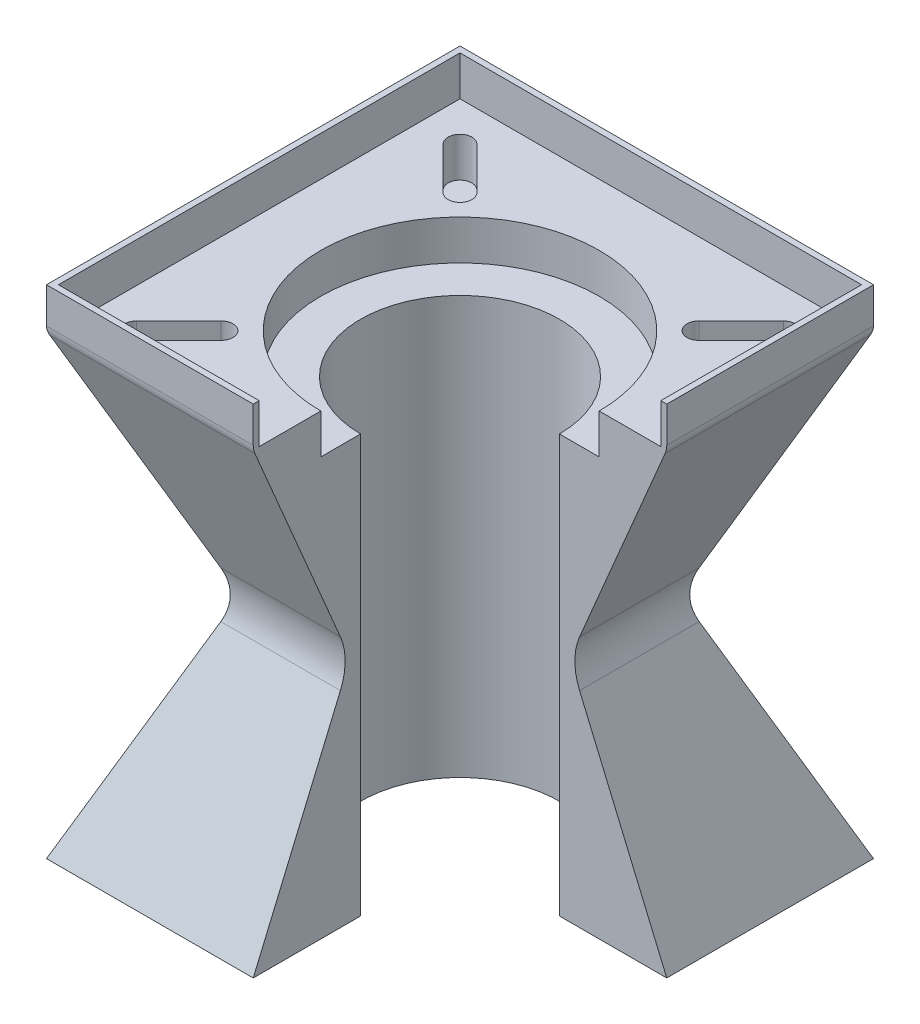
from build123d import *

# Parameters (mm, degrees)
SKETCH1_W               = 104
SKETCH1_H               = 104
BOSS_EXTRUDE1_DEPTH     = 125
CUT_EXTRUDE3_DEPTH      = 125
CUT_EXTRUDE4_DEPTH      = 146.027583583
CUT_EXTRUDE4_DEPTH_BACK = 146.027583583
CUT_EXTRUDE5_DEPTH      = 146.027583583
CUT_EXTRUDE5_DEPTH_BACK = 146.027583583
SKETCH4_R               = 25
SKETCH5_W               = 101
SKETCH5_H               = 101
CUT_EXTRUDE6_DEPTH      = 10
SKETCH6_W               = 52
SKETCH6_H               = 52
CUT_EXTRUDE7_DEPTH      = 125
SKETCH7_W               = 52
SKETCH7_H               = 52
CUT_EXTRUDE8_DEPTH      = 125
SKETCH8_R               = 35
CUT_EXTRUDE9_DEPTH      = 10
CUT_EXTRUDE10_DEPTH     = 10
FILLET3_R               = 5
FILLET4_R               = 15


with BuildPart() as part:
    # Sketch1 → Boss-Extrude1 (new body)
    with BuildSketch(Plane(origin=(0, 0, 0), x_dir=(1, 0, 0), z_dir=(0, 1, 0))):
        Rectangle(SKETCH1_W, SKETCH1_H)
    extrude(amount=BOSS_EXTRUDE1_DEPTH)

    # Sketch2 → Cut-Extrude3 (cut)
    with BuildSketch(Plane.XY.offset(52)):
        Polygon((-27.592698068, 57.5), (-52, 115), (-52, 0), align=None)
        Polygon((52, 0), (52, 115), (27.592698068, 57.5), align=None)
    extrude(amount=-CUT_EXTRUDE3_DEPTH, mode=Mode.SUBTRACT)

    # Sketch3 → Cut-Extrude4 (cut, two sides: drawn at the far end of the back side and taken through both)
    with BuildSketch(Plane(origin=(0, 0, 0), x_dir=(0, 0, -1), z_dir=(1, 0, 0)).offset(-CUT_EXTRUDE4_DEPTH_BACK)):
        Polygon((-52, 115), (-27.592698068, 57.5), (-52, 0), align=None)
        Polygon((52, 115), (27.592698068, 57.5), (52, 0), align=None)
    extrude(amount=CUT_EXTRUDE4_DEPTH + CUT_EXTRUDE4_DEPTH_BACK, mode=Mode.SUBTRACT)

    # Sketch4 → Cut-Extrude5 (cut, two sides: drawn at the far end of the back side and taken through both)
    with BuildSketch(Plane(origin=(0, 125, 0), x_dir=(1, 0, 0), z_dir=(0, 1, 0)).offset(-CUT_EXTRUDE5_DEPTH_BACK)):
        with Locations(Location((0, 0, 0), (0, 0, 270))):
            Circle(SKETCH4_R)
    extrude(amount=CUT_EXTRUDE5_DEPTH + CUT_EXTRUDE5_DEPTH_BACK, mode=Mode.SUBTRACT)

    # Sketch5 → Cut-Extrude6 (cut)
    with BuildSketch(Plane(origin=(0, 125, 0), x_dir=(1, 0, 0), z_dir=(0, 1, 0))):
        Rectangle(SKETCH5_W, SKETCH5_H)
    extrude(amount=-CUT_EXTRUDE6_DEPTH, mode=Mode.SUBTRACT)

    # Sketch6 → Cut-Extrude7 (cut)
    with BuildSketch(Plane(origin=(0, 115, 0), x_dir=(1, 0, 0), z_dir=(0, 1, 0))):
        with Locations((26, -26)):
            Rectangle(SKETCH6_W, SKETCH6_H)
    extrude(amount=-CUT_EXTRUDE7_DEPTH, mode=Mode.SUBTRACT)

    # Sketch7 → Cut-Extrude8 (cut)
    with BuildSketch(Plane(origin=(0, 125, 0), x_dir=(1, 0, 0), z_dir=(0, 1, 0))):
        with Locations((26, -26)):
            Rectangle(SKETCH7_W, SKETCH7_H)
    extrude(amount=-CUT_EXTRUDE8_DEPTH, mode=Mode.SUBTRACT)

    # Sketch8 → Cut-Extrude9 (cut)
    with BuildSketch(Plane(origin=(0, 115, 0), x_dir=(1, 0, 0), z_dir=(0, 1, 0))):
        Circle(SKETCH8_R)
    extrude(amount=-CUT_EXTRUDE9_DEPTH, mode=Mode.SUBTRACT)

    # Sketch9 → Cut-Extrude10 (cut)
    with BuildSketch(Plane(origin=(0, 115, 0), x_dir=(1, 0, 0), z_dir=(0, 1, 0))):
        with BuildLine():
            Line((-38.537319575, 42.779960262), (-27.930717857, 32.173358544))
            ThreePointArc((-27.930717857, 32.173358544), (-27.930717857, 27.930717857), (-32.173358544, 27.930717857))
            Line((-32.173358544, 27.930717857), (-42.779960262, 38.537319575))
            ThreePointArc((-42.779960262, 38.537319575), (-42.779960262, 42.779960262), (-38.537319575, 42.779960262))
        make_face()
        with BuildLine():
            Line((38.537319575, 42.779960262), (27.930717857, 32.173358544))
            ThreePointArc((27.930717857, 32.173358544), (27.930717857, 27.930717857), (32.173358544, 27.930717857))
            Line((32.173358544, 27.930717857), (42.779960262, 38.537319575))
            ThreePointArc((42.779960262, 38.537319575), (42.779960262, 42.779960262), (38.537319575, 42.779960262))
        make_face()
        with BuildLine():
            Line((-38.537319575, -42.779960262), (-27.930717857, -32.173358544))
            ThreePointArc((-27.930717857, -32.173358544), (-27.930717857, -27.930717857), (-32.173358544, -27.930717857))
            Line((-32.173358544, -27.930717857), (-42.779960262, -38.537319575))
            ThreePointArc((-42.779960262, -38.537319575), (-42.779960262, -42.779960262), (-38.537319575, -42.779960262))
        make_face()
    extrude(amount=-CUT_EXTRUDE10_DEPTH, mode=Mode.SUBTRACT)

    # Fillet3
    fillet3_edges = [part.edges().sort_by_distance(p)[0] for p in [
        (-52, 115, 0),
        (52, 115, -26),
        (-26, 115, 52),
        (0, 115, -52),
    ]]
    fillet(fillet3_edges, radius=FILLET3_R)

    # Fillet4
    fillet4_edges = [part.edges().sort_by_distance(p)[0] for p in [
        (-27.592698068, 57.5, 0),
        (27.592698068, 57.5, -13.796349034),
        (-13.796349034, 57.5, 27.592698068),
        (0, 57.5, -27.592698068),
    ]]
    fillet(fillet4_edges, radius=FILLET4_R)


solid = part.part
